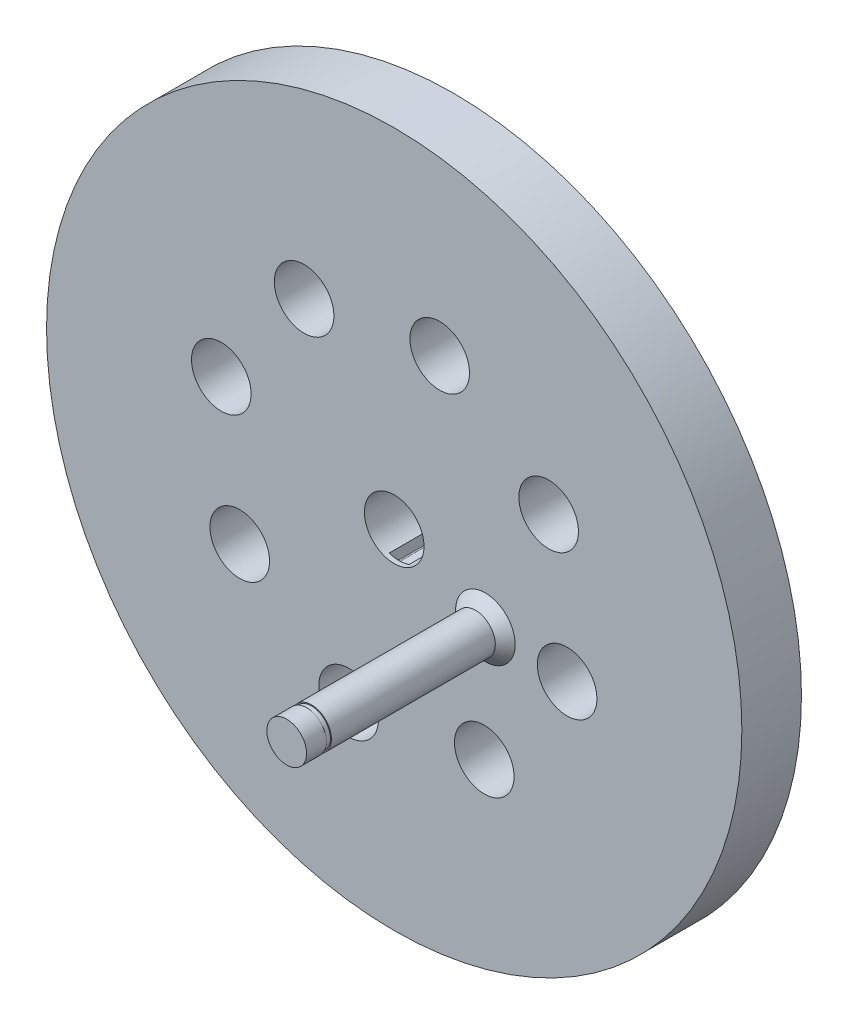
from build123d import *

# Parameters (mm, degrees)
SKETCH_1_R          = 35
SKETCH_1_R_2        = 3
EXTRUDE_1_DEPTH     = 6
SKETCH_3_R          = 3
CUT_EXTRUDE_2_DEPTH = 50.859803449
SKETCH_4_R          = 2
EXTRUDE_2_DEPTH     = 22
SKETCH_7_R          = 4
EXTRUDE_3_DEPTH     = 2
CHAMFER_1_SIZE      = 1
CUT_EXTRUDE_START   = -0.5
SKETCH_9_W          = 2
SKETCH_9_H          = 2
CUT_EXTRUDE_5_DEPTH = 4
FILLET_1_R          = 0.1
SKETCH_12_R         = 4
CUT_EXTRUDE_6_DEPTH = 2
CUT_EXTRUDE_START_2 = -2.5
SKETCH_13_R         = 2
SKETCH_13_R_2       = 1.9
CUT_EXTRUDE_7_DEPTH = 0.5


with BuildPart() as part:
    # 草图1 → 凸台-拉伸1 (new body)
    with BuildSketch(Plane.XY):
        Circle(SKETCH_1_R)
        Circle(SKETCH_1_R_2, mode=Mode.SUBTRACT)
    extrude(amount=EXTRUDE_1_DEPTH)

    # 草图3 → 切除-拉伸2 (cut, through all)
    with BuildSketch(Plane(origin=(0, 0, 0), x_dir=(-1, 0, 0), z_dir=(0, 0, -1))):
        with Locations((-4.582105158, 17.407019053)):
            Circle(SKETCH_3_R)
        with Locations((9.068583583, 15.548658842)):
            Circle(SKETCH_3_R)
        with Locations((17.407019053, 4.582105158)):
            Circle(SKETCH_3_R)
        with Locations((15.548658842, -9.068583583)):
            Circle(SKETCH_3_R)
        with Locations((4.582105158, -17.407019053)):
            Circle(SKETCH_3_R)
        with Locations((-9.068583583, -15.548658842)):
            Circle(SKETCH_3_R)
        with Locations((-17.407019053, -4.582105158)):
            Circle(SKETCH_3_R)
        with Locations((-15.548658842, 9.068583583)):
            Circle(SKETCH_3_R)
    extrude(amount=-CUT_EXTRUDE_2_DEPTH, mode=Mode.SUBTRACT)

    # 草图4 → 凸台-拉伸2 (add)
    with BuildSketch(Plane.XY.offset(6)):
        with Locations((9.178670771, -3.968879298)):
            Circle(SKETCH_4_R)
    extrude(amount=EXTRUDE_2_DEPTH)

    # 草图7 → 凸台-拉伸3 (add)
    with BuildSketch(Plane.XY.offset(28)):
        with Locations((9.178670771, -3.968879298)):
            Circle(SKETCH_7_R)
    extrude(amount=-EXTRUDE_3_DEPTH)

    # 倒角1
    chamfer_1_edges = [part.edges().sort_by_distance(p)[0] for p in [
        (7.178670771, -3.968879298, 6),
    ]]
    chamfer(chamfer_1_edges, length=CHAMFER_1_SIZE)

    # 草图9 → 切除-拉伸5 (cut)
    with BuildSketch(Plane.XY.offset(6).offset(CUT_EXTRUDE_START)):
        with Locations((0, -3)):
            Rectangle(SKETCH_9_W, SKETCH_9_H)
    extrude(amount=-CUT_EXTRUDE_5_DEPTH, mode=Mode.SUBTRACT)

    # 圆角1
    fillet_1_edges = [part.edges().sort_by_distance(p)[0] for p in [
        (1, -4, 3.5),
        (-1, -4, 3.5),
    ]]
    fillet(fillet_1_edges, radius=FILLET_1_R)

    # 草图12 → 切除-拉伸6 (cut)
    with BuildSketch(Plane.XY.offset(28)):
        with Locations((9.178670771, -3.968879298)):
            Circle(SKETCH_12_R)
    extrude(amount=-CUT_EXTRUDE_6_DEPTH, mode=Mode.SUBTRACT)

    # 草图13 → 切除-拉伸7 (cut)
    with BuildSketch(Plane.XY.offset(26).offset(CUT_EXTRUDE_START_2)):
        with Locations((9.178670771, -3.968879298)):
            Circle(SKETCH_13_R)
        with Locations((9.178670771, -3.968879298)):
            Circle(SKETCH_13_R_2, mode=Mode.SUBTRACT)
    extrude(amount=CUT_EXTRUDE_7_DEPTH, mode=Mode.SUBTRACT)


solid = part.part
